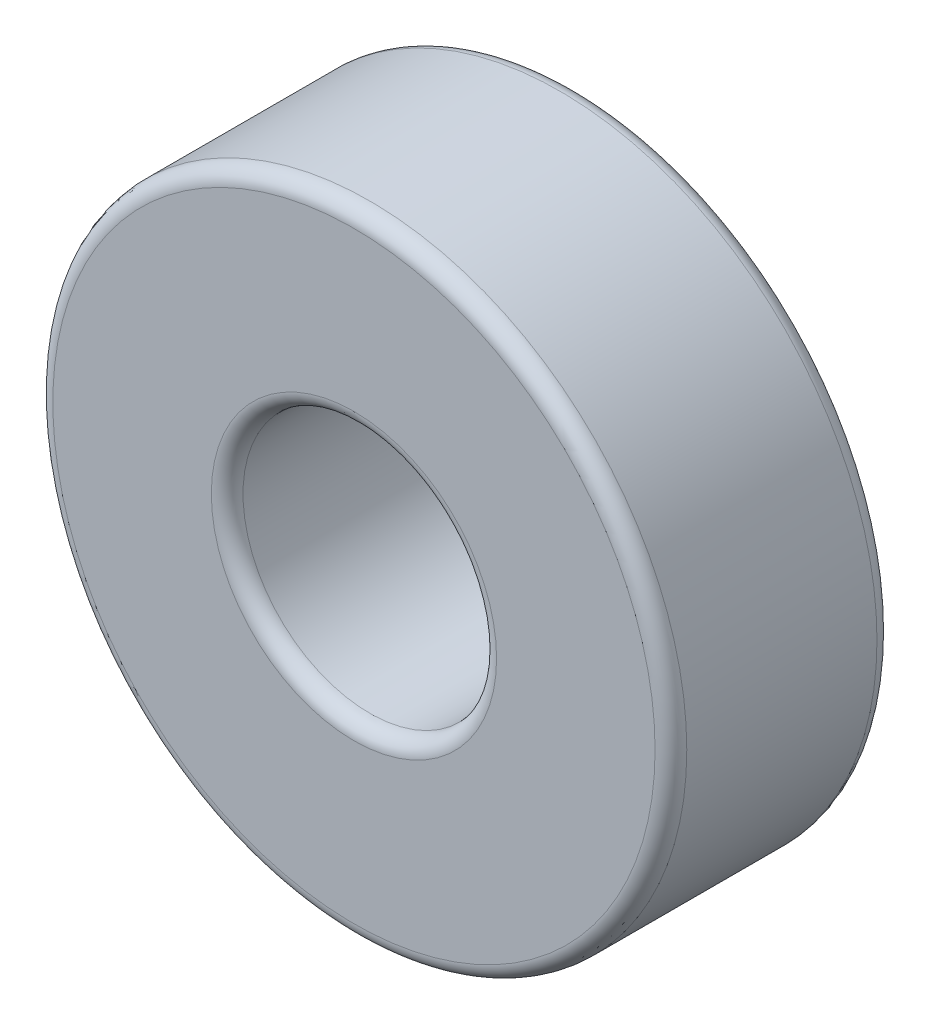
from build123d import *

# Parameters (mm, degrees)
SKETCH1_R           = 10
SKETCH1_R_2         = 4
BOSS_EXTRUDE1_DEPTH = 7
FILLET2_R           = 0.5


with BuildPart() as part:
    # Sketch1 → Boss-Extrude1 (new body)
    with BuildSketch(Plane.XY):
        Circle(SKETCH1_R)
        Circle(SKETCH1_R_2, mode=Mode.SUBTRACT)
    extrude(amount=BOSS_EXTRUDE1_DEPTH)

    # Fillet2
    fillet2_edges = [part.edges().sort_by_distance(p)[0] for p in [
        (-10, 0, 0),
        (-10, 0, 7),
        (-4, 0, 0),
        (-4, 0, 7),
    ]]
    fillet(fillet2_edges, radius=FILLET2_R)


solid = part.part
